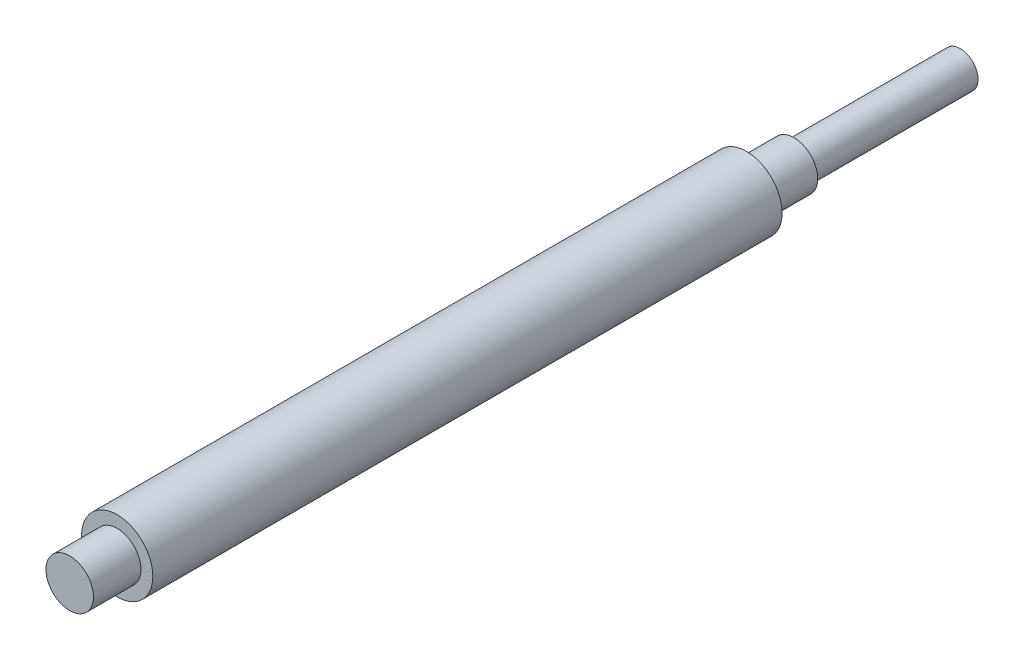
from build123d import *

# Parameters (mm, degrees)
ESBO_O1_R                = 3
RESSALTO_EXTRUS_O1_DEPTH = 75
CORTE_EXTRUS_O1_START    = -4
ESBO_O2_R                = 3
ESBO_O2_R_2              = 2
CORTE_EXTRUS_O1_DEPTH    = 4
ESBO_O3_R                = 3
ESBO_O3_R_2              = 2
CORTE_EXTRUS_O2_DEPTH    = 18
ESBO_O4_R                = 2.5
ESBO_O4_R_2              = 1.5
CORTE_EXTRUS_O3_DEPTH    = 14


with BuildPart() as part:
    # Esboço1 → Ressalto-extrusão1 (new body)
    with BuildSketch(Plane.XY):
        Circle(ESBO_O1_R)
    extrude(amount=RESSALTO_EXTRUS_O1_DEPTH)

    # Esboço2 → Corte-extrusão1 (cut)
    with BuildSketch(Plane.XY.offset(75).offset(CORTE_EXTRUS_O1_START)):
        Circle(ESBO_O2_R)
        Circle(ESBO_O2_R_2, mode=Mode.SUBTRACT)
    extrude(amount=CORTE_EXTRUS_O1_DEPTH, mode=Mode.SUBTRACT)

    # Esboço3 → Corte-extrusão2 (cut)
    with BuildSketch(Plane(origin=(0, 0, 0), x_dir=(-1, 0, 0), z_dir=(0, 0, -1))):
        with Locations(Location((0, 0, 0), (0, 0, 180))):
            Circle(ESBO_O3_R)
        with Locations(Location((0, 0, 0), (0, 0, 180))):
            Circle(ESBO_O3_R_2, mode=Mode.SUBTRACT)
    extrude(amount=-CORTE_EXTRUS_O2_DEPTH, mode=Mode.SUBTRACT)

    # Esboço4 → Corte-extrusão3 (cut)
    with BuildSketch(Plane(origin=(0, 0, 0), x_dir=(-1, 0, 0), z_dir=(0, 0, -1))):
        Circle(ESBO_O4_R)
        Circle(ESBO_O4_R_2, mode=Mode.SUBTRACT)
    extrude(amount=-CORTE_EXTRUS_O3_DEPTH, mode=Mode.SUBTRACT)


solid = part.part
